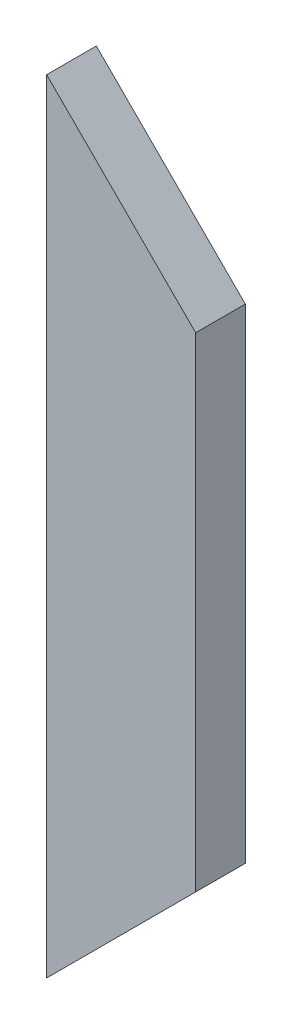
from build123d import *

# Parameters (mm, degrees)
SKETCH1_W           = 76.2
SKETCH1_H           = 400.05
BOSS_EXTRUDE1_DEPTH = 25.4
CUT_EXTRUDE1_DEPTH  = 25.4


with BuildPart() as part:
    # Sketch1 → Boss-Extrude1 (new body)
    with BuildSketch(Plane.XY):
        Rectangle(SKETCH1_W, SKETCH1_H)
    extrude(amount=BOSS_EXTRUDE1_DEPTH)

    # Sketch2 → Cut-Extrude1 (cut)
    with BuildSketch(Plane.XY):
        Polygon((-38.1, 200.025), (38.1, 123.825), (38.1, 200.025), align=None)
        Polygon((-38.1, -200.025), (38.1, -123.825), (38.1, -200.025), align=None)
    extrude(amount=CUT_EXTRUDE1_DEPTH, mode=Mode.SUBTRACT)


solid = part.part
